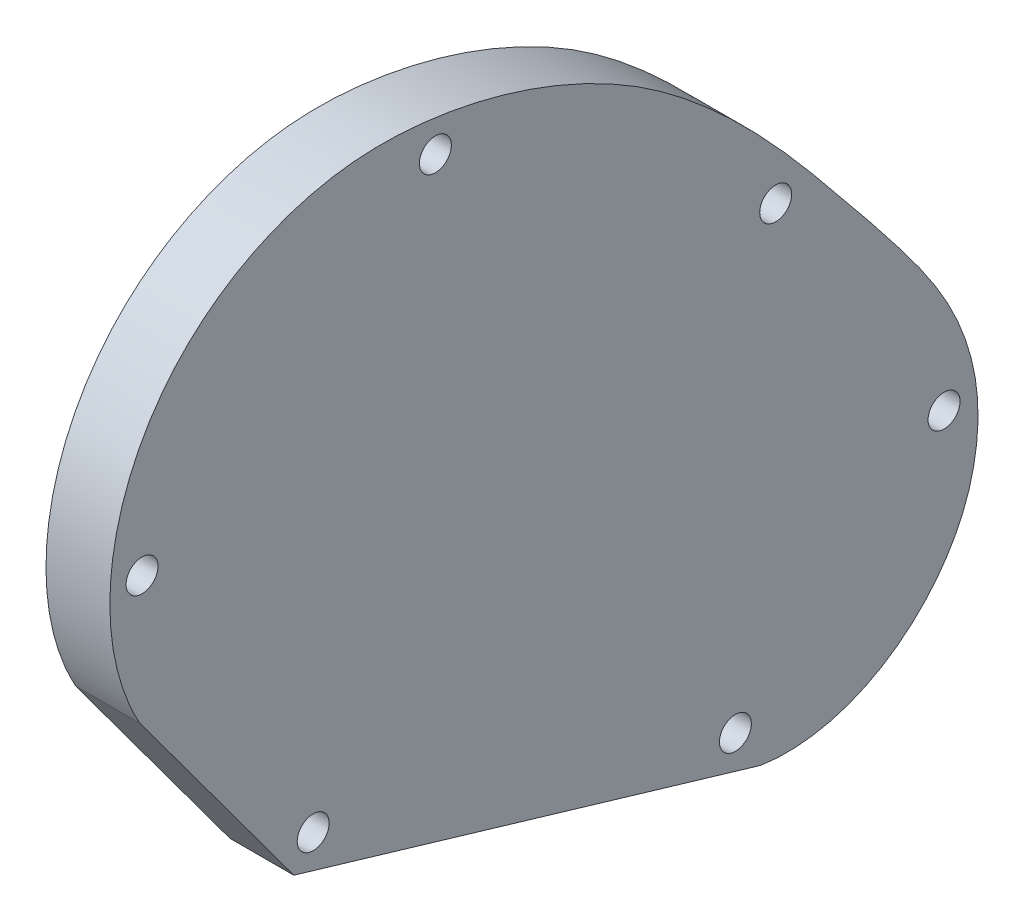
from build123d import *

# Parameters (mm, degrees)
BOSS_EXTRUDE1_DEPTH = 5.08
SKETCH4_R           = 1.27
CUT_EXTRUDE1_DEPTH  = 5.08


with BuildPart() as part:
    # Sketch3 → Boss-Extrude1 (new body)
    with BuildSketch(Plane(origin=(0, 0, 0), x_dir=(0, 0, -1), z_dir=(1, 0, 0))):
        with BuildLine():
            Line((-47.441668349, 27.842074628), (-35.181732411, 11.231316753))
            Line((-35.181732411, 11.231316753), (1.949605381, 0.233471835))
            add(Edge.make_bspline(
                [(1.949605381, 0.233471835), (4.890290938, -0.232032838), (10.160071566, 0.735147888), (15.611977012, 5.149067238), (18.884368216, 10.647091461), (19.674030919, 17.241164019), (17.440635046, 24.216151913), (13.232560428, 30.12920969), (8.551401796, 35.89852438), (3.827620866, 41.665894045), (-1.370765068, 47.027165705), (-7.261234365, 51.79701328), (-14.7784376, 55.698212535), (-22.952033614, 57.992508455), (-31.974324582, 58.334446998), (-39.470610931, 55.71072363), (-45.272350716, 50.773717258), (-48.759778621, 44.89399317), (-50.430145497, 36.809256899), (-49.168255002, 30.946562306), (-47.441668349, 27.842074628)],
                knots=[0, 0, 0, 0, 0.064655629, 0.112182171, 0.149245604, 0.202687261, 0.251878753, 0.306377364, 0.36071414, 0.414932945, 0.469634396, 0.524171798, 0.580244221, 0.654105555, 0.708421188, 0.775974658, 0.822312066, 0.872983652, 0.922833719, 1, 1, 1, 1], degree=3))
        make_face()
    extrude(amount=BOSS_EXTRUDE1_DEPTH)

    # Sketch4 → Cut-Extrude1 (cut)
    with BuildSketch(Plane.ZY):
        with Locations((33.643824541, 13.424879002)):
            Circle(SKETCH4_R)
        with Locations((47.252672641, 37.921847406)):
            Circle(SKETCH4_R)
        with Locations((23.925350422, 55.256282012)):
            Circle(SKETCH4_R)
        with Locations((-3.138060322, 38.344834007)):
            Circle(SKETCH4_R)
        with Locations((-16.525859122, 17.375384785)):
            Circle(SKETCH4_R)
        with Locations((0.06701047, 3.47984023)):
            Circle(SKETCH4_R)
    extrude(amount=-CUT_EXTRUDE1_DEPTH, mode=Mode.SUBTRACT)


solid = part.part
